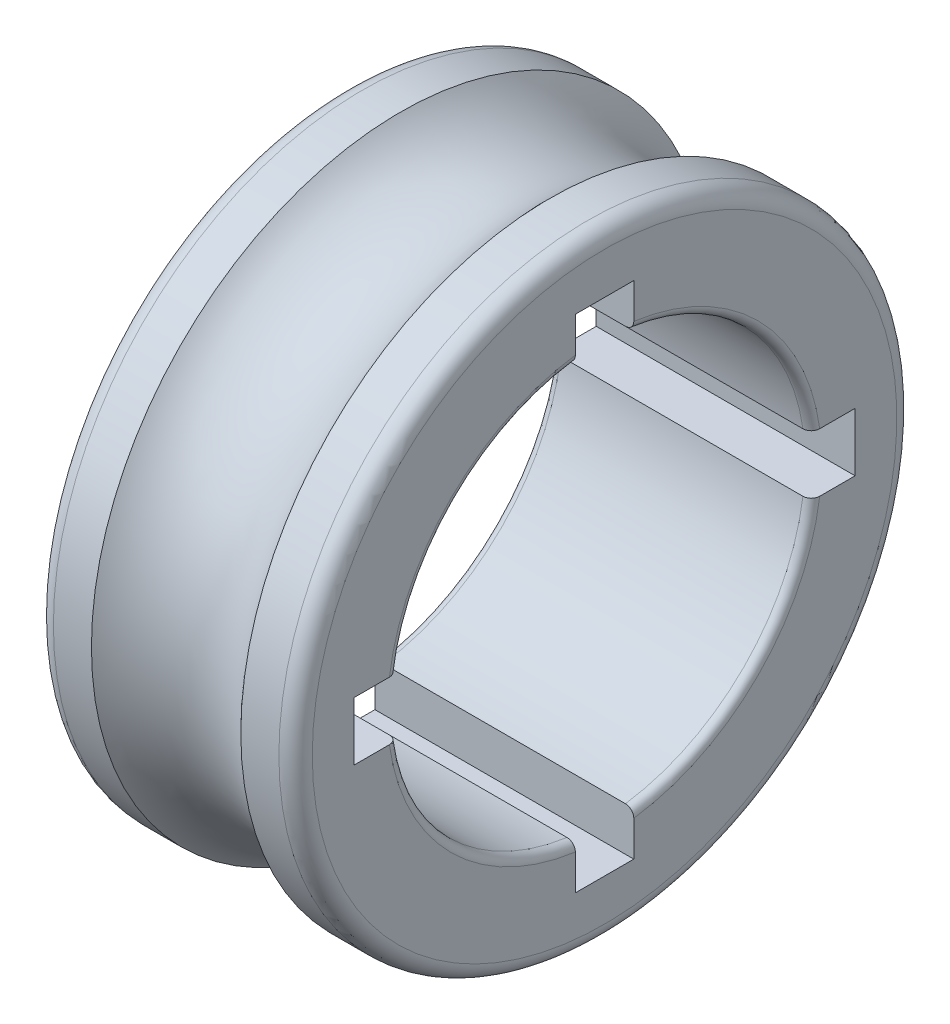
from build123d import *

# Parameters (mm, degrees)
SKETCH2_W          = 7
SKETCH2_H          = 60
CUT_EXTRUDE1_DEPTH = 55.57334521
CIRPATTERN1_COUNT  = 4


with BuildPart() as part:
    # Sketch1 → Revolve1 (revolve)
    with BuildSketch(Plane.XY, mode=Mode.PRIVATE) as revolve1_sk:
        with BuildLine():
            Line((-13.5, 37), (-8.94427191, 37))
            ThreePointArc((-8.94427191, 37), (0, 33), (8.94427191, 37))
            Line((8.94427191, 37), (13.5, 37))
            ThreePointArc((13.5, 37), (14.914213562, 36.414213562), (15.5, 35))
            Line((15.5, 35), (15.5, 26))
            ThreePointArc((15.5, 26), (15.207106781, 25.292893219), (14.5, 25))
            Line((14.5, 25), (-14.5, 25))
            ThreePointArc((-14.5, 25), (-15.207106781, 25.292893219), (-15.5, 26))
            Line((-15.5, 26), (-15.5, 35))
            ThreePointArc((-15.5, 35), (-14.914213562, 36.414213562), (-13.5, 37))
        make_face()
    revolve(revolve1_sk.sketch.rotate(Axis((0, 0, 0), (1, 0, 0)), 90), axis=Axis((0, 0, 0), (1, 0, 0)))

    # Sketch2 → Cut-Extrude1 (cut, symmetric)
    with BuildSketch(Plane(origin=(0, 0, 0), x_dir=(0, 0, -1), z_dir=(1, 0, 0))):
        Rectangle(SKETCH2_W, SKETCH2_H)
    cut_extrude1 = extrude(amount=CUT_EXTRUDE1_DEPTH, both=True, mode=Mode.SUBTRACT)

    # CirPattern1: Cut-Extrude1 ×4 about axis
    cirpattern1_axis = Axis((0, 0, 0), (1, 0, 0))
    for i in range(1, CIRPATTERN1_COUNT):
        add(cut_extrude1.rotate(cirpattern1_axis, i * 360 / CIRPATTERN1_COUNT), mode=Mode.SUBTRACT)


solid = part.part
